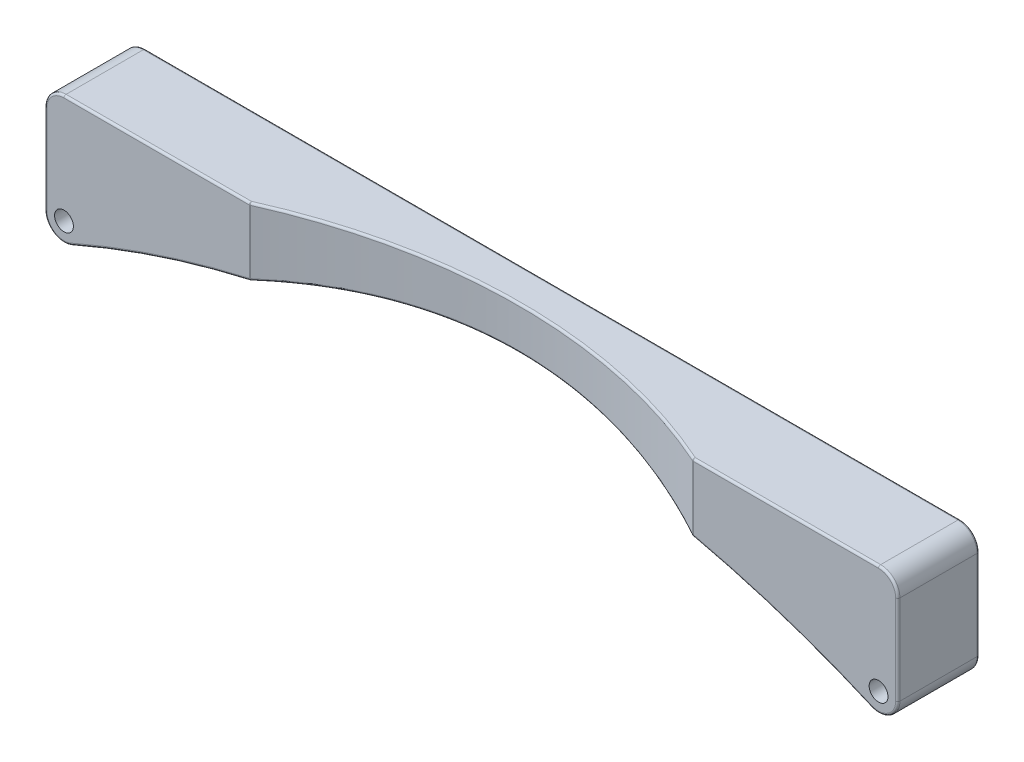
from build123d import *

# Parameters (mm, degrees)
SKETCH1_R               = 4.5
SKETCH1_R_2             = 2.2
BOSS_EXTRUDE1_DEPTH     = 19.05
CUT_EXTRUDE1_REACH      = 200.197
CUT_EXTRUDE1_END_RADIUS = 233.403831658
FILLET1_R               = 0.5


with BuildPart() as part:
    # Sketch1 → Boss-Extrude1 (new body)
    # profile 1 of 5: a face of its own
    with BuildSketch(Plane.XY):
        with BuildLine():
            Line((190.5, 25.4), (0, 25.4))
            ThreePointArc((0, 25.4), (3.181980515, 24.081980515), (4.5, 20.9))
            ThreePointArc((4.5, 20.9), (0, 16.4), (-4.5, 20.9))
            Line((-4.5, 20.9), (-4.5, 0))
            ThreePointArc((-4.5, 0), (0, 4.5), (4.5, 0))
            ThreePointArc((4.5, 0), (3.765470156, -2.463987521), (1.801673554, -4.123587322))
            ThreePointArc((1.801673554, -4.123587322), (95.249999978, 15.4), (188.698326405, -4.123587304))
            ThreePointArc((188.698326405, -4.123587304), (188.036012498, 3.765470168), (195, 0))
            Line((195, 0), (195, 20.9))
            ThreePointArc((195, 20.9), (187.318019485, 17.718019485), (190.5, 25.4))
        make_face()
    # profile 2 of 5: a face of its own
    with BuildSketch(Plane.XY):
        Circle(SKETCH1_R)
        with Locations(Location((0, 0, 0), (0, 0, 180))):
            Circle(SKETCH1_R_2, mode=Mode.SUBTRACT)
    # profile 3 of 5: a face of its own
    with BuildSketch(Plane.XY):
        with Locations((0, 20.9)):
            Circle(SKETCH1_R)
    # profile 4 of 5: a face of its own
    with BuildSketch(Plane.XY):
        with Locations((190.5, 20.9)):
            Circle(SKETCH1_R)
    # profile 5 of 5: a face of its own
    with BuildSketch(Plane.XY):
        with Locations((190.5, 0)):
            Circle(SKETCH1_R)
        with Locations(Location((190.5, 0, 0), (0, 0, 180))):
            Circle(SKETCH1_R_2, mode=Mode.SUBTRACT)
    extrude(amount=BOSS_EXTRUDE1_DEPTH)

    # Cut-Extrude1: up to this cylinder (the profile starts outside it)
    cut_extrude1_end = Plane(origin=(95.25, -218.003831658, 75.735711), z_dir=(0, 0, -1)) * Cylinder(CUT_EXTRUDE1_END_RADIUS, 990.446901317, mode=Mode.PRIVATE)
    # Sketch2 → Cut-Extrude1 (cut, up to the surface)
    with BuildSketch(Plane(origin=(0, 25.4, 0), x_dir=(1, 0, 0), z_dir=(0, 1, 0)), mode=Mode.PRIVATE) as cut_extrude1_sk1:
        with BuildLine():
            ThreePointArc((43.436898375, -19.05), (26.153197999, -241.558115379), (222.25, -135))
            ThreePointArc((222.25, -135), (201.808115379, -65.903197999), (147.063101625, -19.05))
            Line((147.063101625, -19.05), (43.436898375, -19.05))
        make_face()
    cut_extrude1_tool1 = extrude(cut_extrude1_sk1.sketch, amount=-CUT_EXTRUDE1_REACH, mode=Mode.PRIVATE) - cut_extrude1_end
    add(cut_extrude1_tool1.solids().sort_by_distance((95.25, 25.4, 136.85833))[0], mode=Mode.SUBTRACT)
    # Sketch2 → Cut-Extrude1 (cut, up to the surface)
    with BuildSketch(Plane(origin=(0, 25.4, 0), x_dir=(1, 0, 0), z_dir=(0, 1, 0)), mode=Mode.PRIVATE) as cut_extrude1_sk2:
        with BuildLine():
            Line((43.436898375, -19.05), (147.063101625, -19.05))
            ThreePointArc((147.063101625, -19.05), (95.25, -8), (43.436898375, -19.05))
        make_face()
    cut_extrude1_tool2 = extrude(cut_extrude1_sk2.sketch, amount=-CUT_EXTRUDE1_REACH, mode=Mode.PRIVATE) - cut_extrude1_end
    add(cut_extrude1_tool2.solids().sort_by_distance((95.25, 25.4, 14.613092))[0], mode=Mode.SUBTRACT)

    # Fillet1
    fillet1_edges = [part.edges().sort_by_distance(p)[0] for p in [
        (192.963987502, -3.765470168, 19.05),
        (-2.463987521, -3.765470156, 0),
        (-4.5, 10.45, 0),
        (-3.181980515, 24.081980515, 0),
        (95.25, 25.4, 0),
        (193.681980515, 24.081980515, 0),
        (195, 10.45, 0),
        (192.963987502, -3.765470168, 0),
        (95.249999978, 15.4, 0),
        (195, 10.45, 19.05),
        (193.681980515, 24.081980515, 19.05),
        (21.718449188, 25.4, 19.05),
        (-3.181980515, 24.081980515, 19.05),
        (22.29698174, 3.70590146, 19.05),
        (168.781550812, 25.4, 19.05),
        (-4.5, 10.45, 19.05),
        (147.063101625, 17.488188236, 19.05),
        (95.25, 15.4, 8),
        (43.436898375, 17.488188236, 19.05),
        (95.25, 25.4, 8),
        (-2.463987521, -3.765470156, 19.05),
        (168.203018239, 3.705901467, 19.05),
    ]]
    fillet(fillet1_edges, radius=FILLET1_R)


solid = part.part
